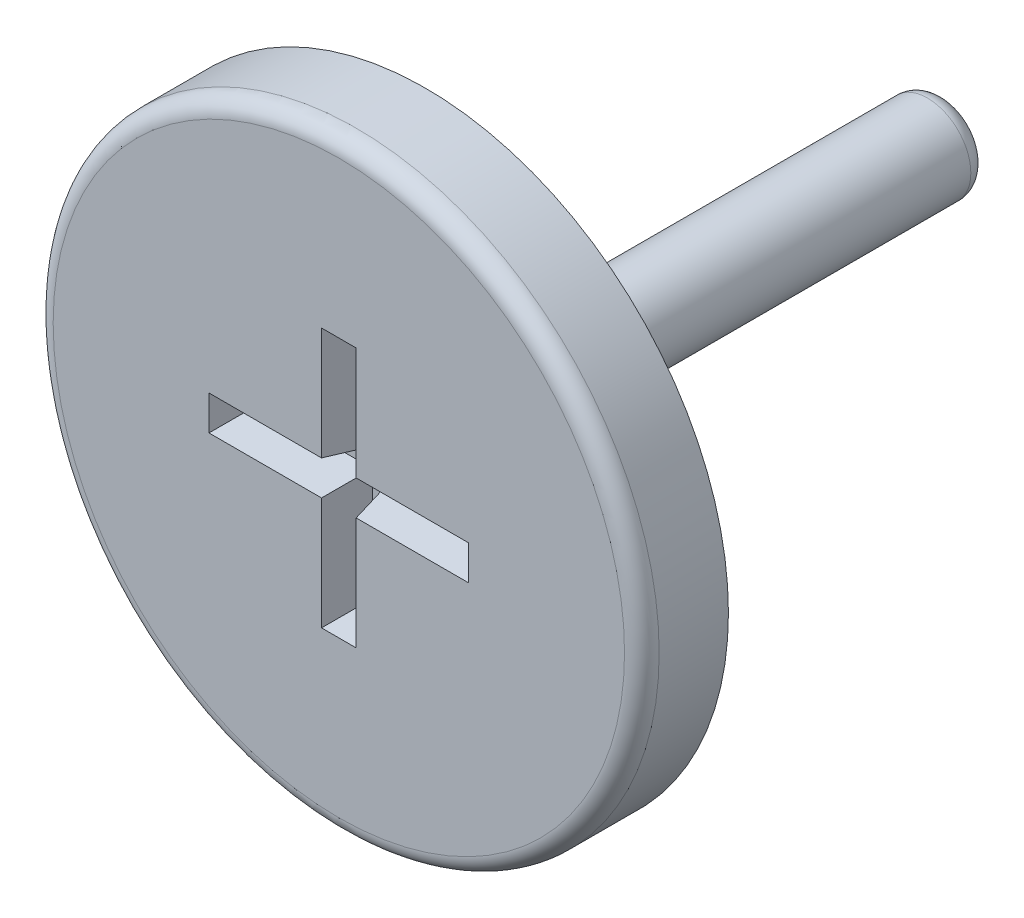
from build123d import *

# Parameters (mm, degrees)
SKETCH1_R           = 3.5
BOSS_EXTRUDE1_DEPTH = 1
SKETCH2_R           = 0.5
BOSS_EXTRUDE2_DEPTH = 6
FILLET1_R           = 0.2
CUT_EXTRUDE1_DEPTH  = 0.5
CUT_EXTRUDE1_DRAFT  = -10
FILLET2_R           = 0.2


with BuildPart() as part:
    # Sketch1 → Boss-Extrude1 (new body)
    with BuildSketch(Plane.XY):
        Circle(SKETCH1_R)
    extrude(amount=BOSS_EXTRUDE1_DEPTH)

    # Sketch2 → Boss-Extrude2 (add)
    with BuildSketch(Plane(origin=(0, 0, 0), x_dir=(-1, 0, 0), z_dir=(0, 0, -1))):
        with Locations(Location((0, 0, 0), (0, 0, 180))):
            Circle(SKETCH2_R)
    extrude(amount=BOSS_EXTRUDE2_DEPTH)

    # Fillet1
    fillet1_edges = [part.edges().sort_by_distance(p)[0] for p in [
        (-3.5, 0, 1),
    ]]
    fillet(fillet1_edges, radius=FILLET1_R)


with BuildPart() as cut_extrude1_tool:
    # Sketch3 → Cut-Extrude1 (with draft: the straight prism first)
    with BuildSketch(Plane.XY.offset(1)):
        Polygon((-0.2, -0.2), (-0.2, -1.5), (0.2, -1.5), (0.2, -0.2), (1.5, -0.2), (1.5, 0.2), (0.2, 0.2), (0.2, 1.5), (-0.2, 1.5), (-0.2, 0.2), (-1.5, 0.2), (-1.5, -0.2), align=None)
    extrude(amount=-CUT_EXTRUDE1_DEPTH)
    # Cut-Extrude1: the draft: its side faces are tilted about the plane it starts from
    cut_extrude1_sides = [cut_extrude1_tool.faces().sort_by_distance(p)[0] for p in [
        (-0.2, -0.85, 0.75),
        (0, -1.5, 0.75),
        (0.2, -0.85, 0.75),
        (0.85, -0.2, 0.75),
        (1.5, 0, 0.75),
        (0.85, 0.2, 0.75),
        (0.2, 0.85, 0.75),
        (0, 1.5, 0.75),
        (-0.2, 0.85, 0.75),
        (-0.85, 0.2, 0.75),
        (-1.5, 0, 0.75),
        (-0.85, -0.2, 0.75),
    ]]
    draft(cut_extrude1_sides, Plane.XY.offset(1), CUT_EXTRUDE1_DRAFT)


with BuildPart() as part_1:
    add(part.part)

    # Cut-Extrude1: cut by cut_extrude1_tool
    add(cut_extrude1_tool.part, mode=Mode.SUBTRACT)

    # Fillet2
    fillet2_edges = [part_1.edges().sort_by_distance(p)[0] for p in [
        (-0.5, 0, -6),
    ]]
    fillet(fillet2_edges, radius=FILLET2_R)


solid = part_1.part
